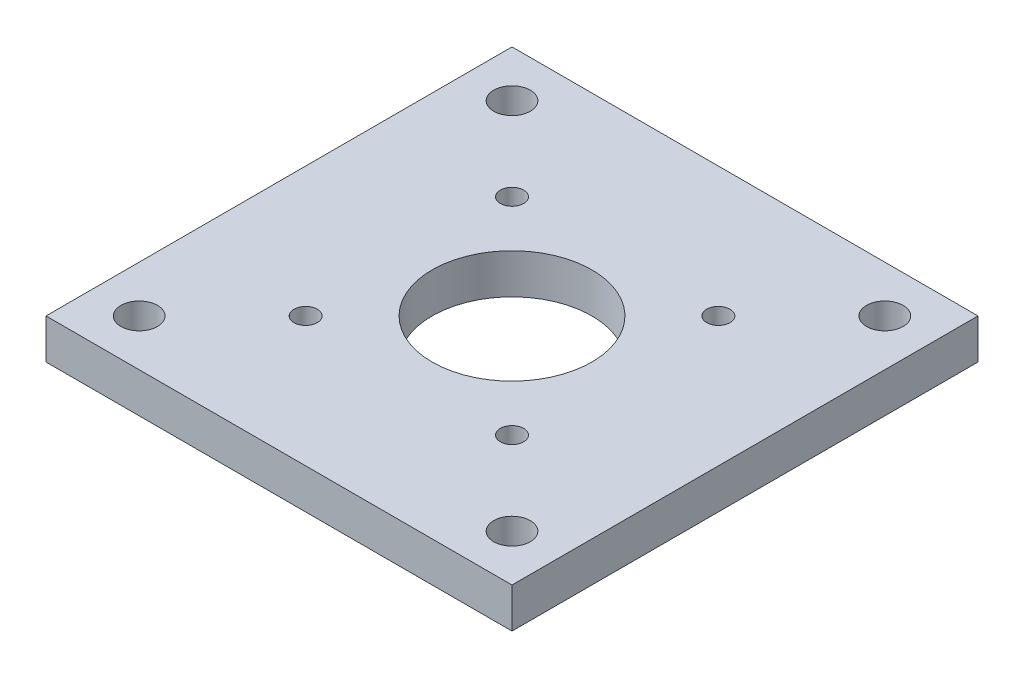
from build123d import *

# Parameters (mm, degrees)
SKETCH4_W           = 70
SKETCH4_H           = 70
SKETCH4_R           = 12
BOSS_EXTRUDE2_DEPTH = 6
SKETCH5_R           = 1.75
CUT_EXTRUDE1_DEPTH  = 50.859803449
SKETCH6_R           = 2.75
CUT_EXTRUDE2_DEPTH  = 50.859803449


with BuildPart() as part:
    # Sketch4 → Boss-Extrude2 (new body)
    with BuildSketch(Plane(origin=(0, 0, 0), x_dir=(1, 0, 0), z_dir=(0, 1, 0))):
        Rectangle(SKETCH4_W, SKETCH4_H)
        with Locations(Location((0, 0, 0), (0, 0, 270))):
            Circle(SKETCH4_R, mode=Mode.SUBTRACT)
    extrude(amount=BOSS_EXTRUDE2_DEPTH)

    # Sketch5 → Cut-Extrude1 (cut, through all)
    with BuildSketch(Plane(origin=(0, 6, 0), x_dir=(1, 0, 0), z_dir=(0, 1, 0))):
        with Locations(Location((-15.5, 15.5, 0), (0, 0, 270))):
            Circle(SKETCH5_R)
        with Locations(Location((15.5, 15.5, 0), (0, 0, 90))):
            Circle(SKETCH5_R)
        with Locations(Location((15.5, -15.5, 0), (0, 0, 270))):
            Circle(SKETCH5_R)
        with Locations(Location((-15.5, -15.5, 0), (0, 0, 90))):
            Circle(SKETCH5_R)
    extrude(amount=-CUT_EXTRUDE1_DEPTH, mode=Mode.SUBTRACT)

    # Sketch6 → Cut-Extrude2 (cut, through all)
    with BuildSketch(Plane(origin=(0, 6, 0), x_dir=(1, 0, 0), z_dir=(0, 1, 0))):
        with Locations(Location((-28, 28, 0), (0, 0, 270))):
            Circle(SKETCH6_R)
        with Locations(Location((28, 28, 0), (0, 0, 90))):
            Circle(SKETCH6_R)
        with Locations(Location((28, -28, 0), (0, 0, 270))):
            Circle(SKETCH6_R)
        with Locations(Location((-28, -28, 0), (0, 0, 90))):
            Circle(SKETCH6_R)
    extrude(amount=-CUT_EXTRUDE2_DEPTH, mode=Mode.SUBTRACT)


solid = part.part
